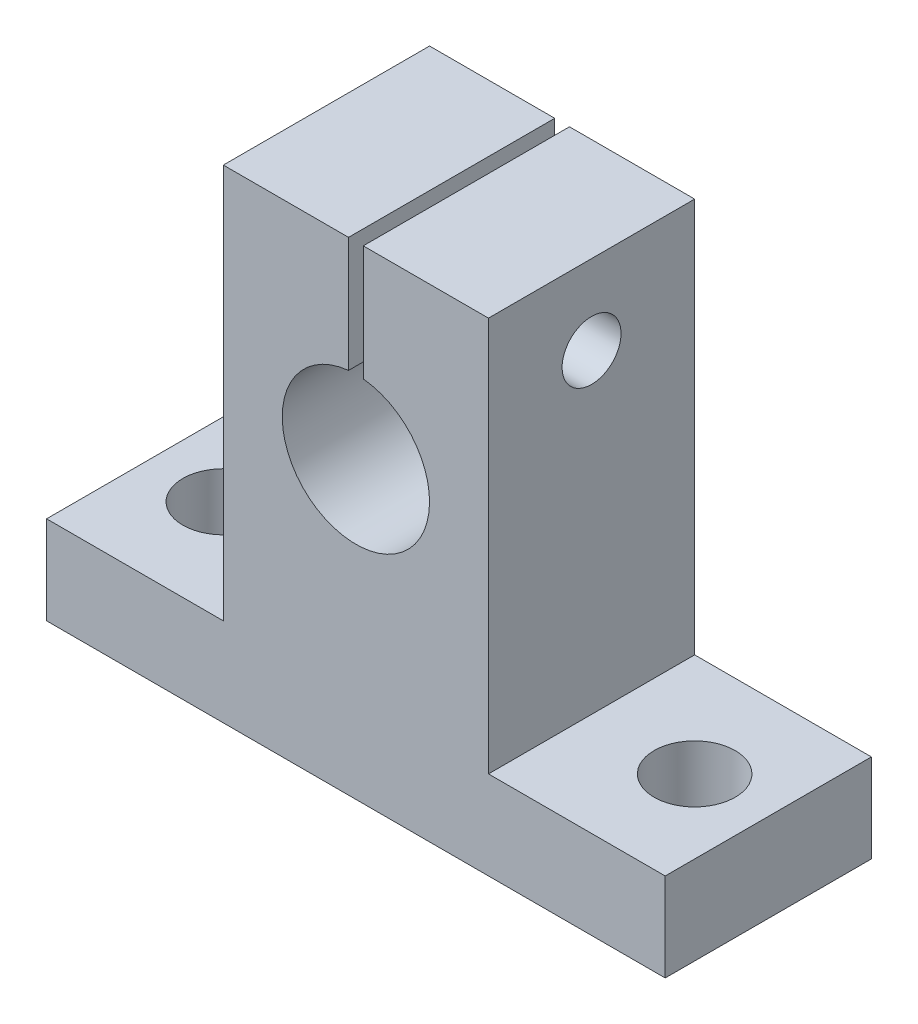
from build123d import *

# Parameters (mm, degrees)
SKETCH_3_R          = 5
EXTRUDE_3_DEPTH     = 7
SKETCH_5_R          = 2.75
CUT_EXTRUDE_1_DEPTH = 10
SKETCH_6_W          = 1
SKETCH_6_H          = 13.139857665
CUT_EXTRUDE_2_DEPTH = 14
SKETCH_7_R          = 2
CUT_EXTRUDE_3_DEPTH = 37.405494091


with BuildPart() as part:
    # 草图3 → 凸台-拉伸3 (new, symmetric)
    with BuildSketch(Plane.XY):
        Polygon((-9, -13.4), (-21, -13.4), (-21, -19.4), (21, -19.4), (21, -13.4), (9, -13.4), (9, 13.4), (-9, 13.4), align=None)
        with Locations((0, 0.6)):
            Circle(SKETCH_3_R, mode=Mode.SUBTRACT)
    extrude(amount=EXTRUDE_3_DEPTH, both=True)

    # 草图5 → 切除-拉伸1 (cut)
    with BuildSketch(Plane(origin=(0, -13.4, 0), x_dir=(1, 0, 0), z_dir=(0, 1, 0))):
        with Locations(Location((-16, 0, 0), (0, 0, 270))):
            Circle(SKETCH_5_R)
        with Locations(Location((16, 0, 0), (0, 0, 180))):
            Circle(SKETCH_5_R)
    extrude(amount=-CUT_EXTRUDE_1_DEPTH, mode=Mode.SUBTRACT)

    # 草图6 → 切除-拉伸2 (cut)
    with BuildSketch(Plane.XY.offset(7)):
        with Locations((0, 10.029998353)):
            Rectangle(SKETCH_6_W, SKETCH_6_H)
    extrude(amount=-CUT_EXTRUDE_2_DEPTH, mode=Mode.SUBTRACT)

    # 草图7 → 切除-拉伸3 (cut, through all)
    with BuildSketch(Plane(origin=(9, 0, 0), x_dir=(0, 0, -1), z_dir=(1, 0, 0))):
        with Locations(Location((0, 8, 0), (0, 0, 90))):
            Circle(SKETCH_7_R)
    extrude(amount=-CUT_EXTRUDE_3_DEPTH, mode=Mode.SUBTRACT)


solid = part.part
